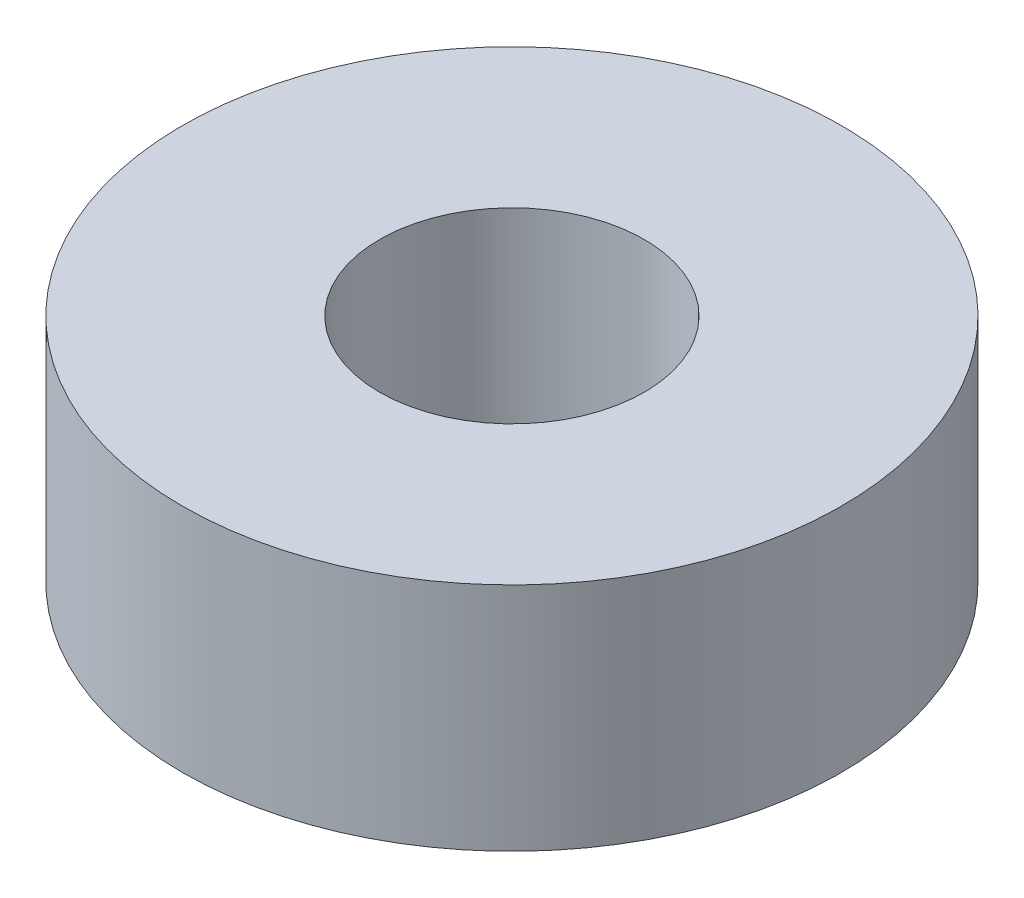
from build123d import *

# Parameters (mm, degrees)
SKETCH1_R           = 6.35
SKETCH1_R_2         = 2.55
BOSS_EXTRUDE1_DEPTH = 4.445


with BuildPart() as part:
    # Sketch1 → Boss-Extrude1 (new body)
    with BuildSketch(Plane(origin=(0, 0, 0), x_dir=(1, 0, 0), z_dir=(0, 1, 0))):
        with Locations(Location((0, 0, 0), (0, 0, 270))):
            Circle(SKETCH1_R)
        with Locations(Location((0, 0, 0), (0, 0, 270))):
            Circle(SKETCH1_R_2, mode=Mode.SUBTRACT)
    extrude(amount=BOSS_EXTRUDE1_DEPTH)


solid = part.part
